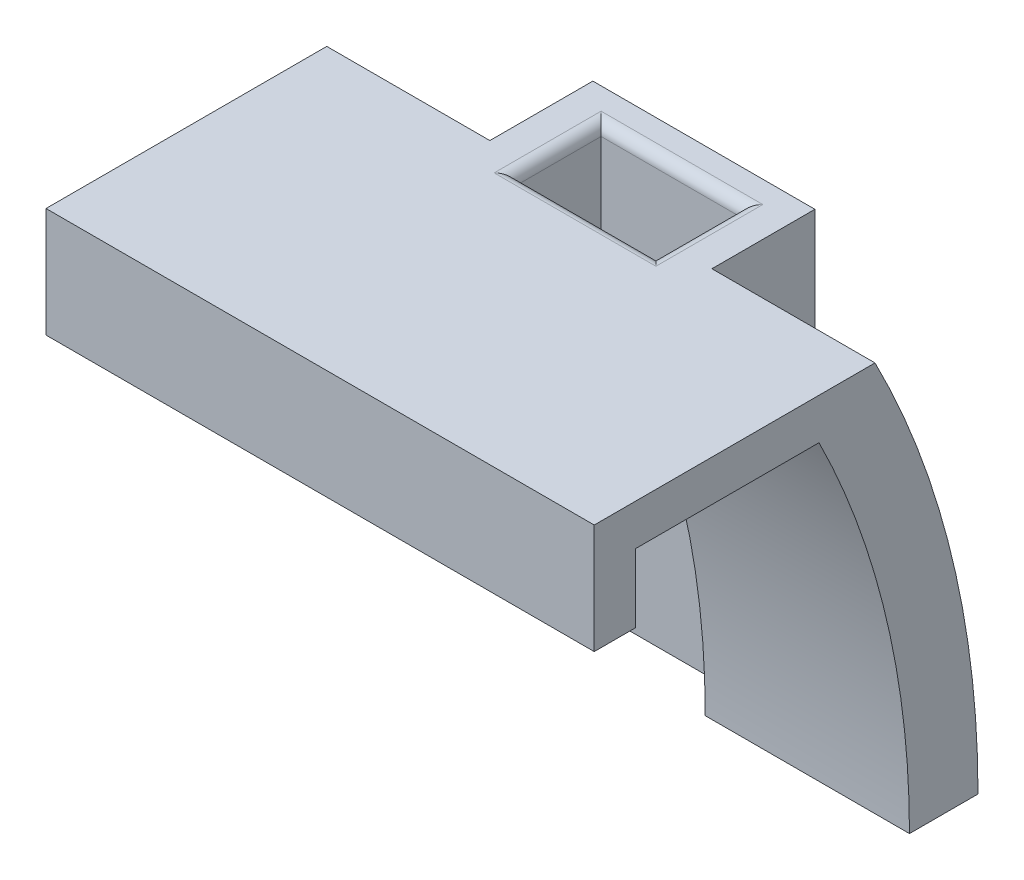
from build123d import *

# Parameters (mm, degrees)
BOSS_EXTRUDE1_DEPTH = 25.4
BOSS_EXTRUDE2_DEPTH = 10.287
SKETCH4_W           = 12.954
SKETCH4_H           = 7.874
CUT_EXTRUDE1_DEPTH  = 57.596991086
FILLET2_R           = 1.016


with BuildPart() as part:
    # Sketch2 → Boss-Extrude1 (new, symmetric)
    with BuildSketch(Plane(origin=(0, 0, 0), x_dir=(0, 0, -1), z_dir=(1, 0, 0))):
        with BuildLine():
            Line((0, 0), (0, -6.35))
            Line((0, -6.35), (-3.81, -6.35))
            Line((-3.81, -6.35), (-3.81, 3.81))
            Line((-3.81, 3.81), (22.20557735, 3.81))
            ThreePointArc((22.20557735, 3.81), (29.329829331, -15.304797559), (31.75, -35.56))
            Line((31.75, -35.56), (25.4, -35.56))
            ThreePointArc((25.4, -35.56), (23.276174446, -17.292737452), (17.018, 0))
            Line((17.018, 0), (0, 0))
        make_face()
    extrude(amount=BOSS_EXTRUDE1_DEPTH, both=True)

    # Sketch3 → Boss-Extrude2 (add, symmetric)
    with BuildSketch(Plane(origin=(0, 0, 0), x_dir=(0, 0, -1), z_dir=(1, 0, 0))):
        Polygon((31.75, -35.56), (31.75, 3.81), (22.20557735, 3.81), align=None)
    extrude(amount=BOSS_EXTRUDE2_DEPTH, both=True)

    # Sketch4 → Cut-Extrude1 (cut, through all)
    with BuildSketch(Plane(origin=(0, 3.81, 0), x_dir=(1, 0, 0), z_dir=(0, 1, 0))):
        with Locations((0, 24.765)):
            Rectangle(SKETCH4_W, SKETCH4_H)
    extrude(amount=-CUT_EXTRUDE1_DEPTH, mode=Mode.SUBTRACT)

    # Fillet2
    fillet2_edges = [part.edges().sort_by_distance(p)[0] for p in [
        (-6.477, 3.81, -24.765),
        (0, 3.81, -20.828),
        (6.477, 3.81, -24.765),
        (0, 3.81, -28.702),
    ]]
    fillet(fillet2_edges, radius=FILLET2_R)


solid = part.part
